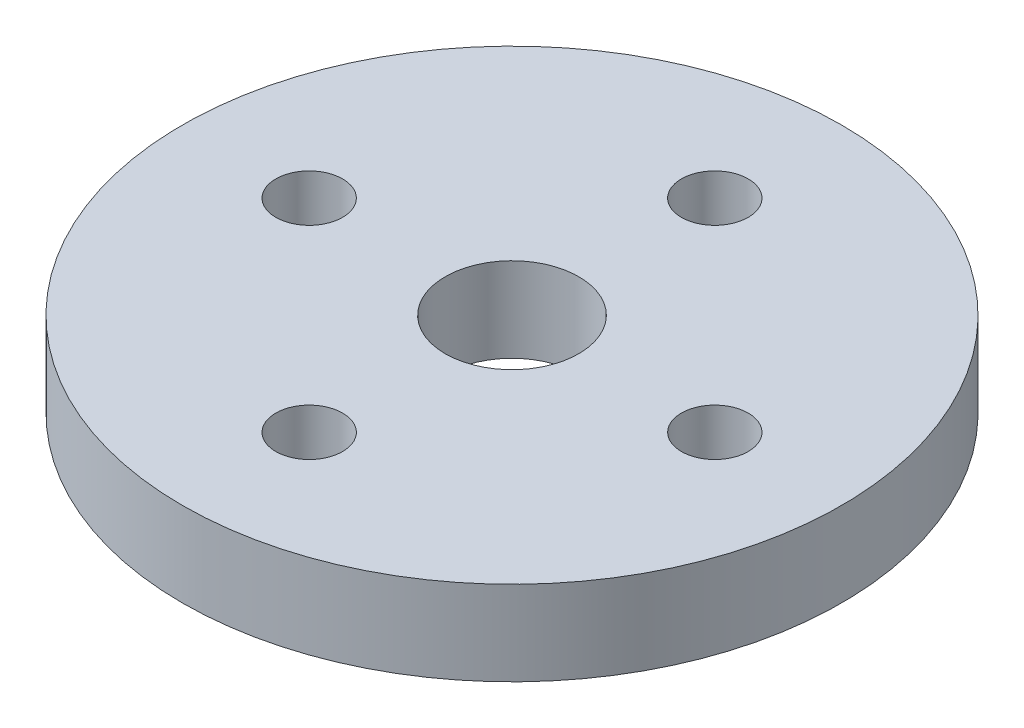
from build123d import *

# Parameters (mm, degrees)
SKETCH1_R           = 19.5
SKETCH1_R_2         = 3.95
SKETCH1_R_3         = 1.975
BOSS_EXTRUDE1_DEPTH = 5


with BuildPart() as part:
    # Sketch1 → Boss-Extrude1 (new body)
    with BuildSketch(Plane(origin=(0, 0, 0), x_dir=(1, 0, 0), z_dir=(0, 1, 0))):
        with Locations(Location((0, 0, 0), (0, 0, 270))):
            Circle(SKETCH1_R)
        with Locations(Location((0, 0, 0), (0, 0, 270))):
            Circle(SKETCH1_R_2, mode=Mode.SUBTRACT)
        with Locations(Location((0, 12, 0), (0, 0, 270))):
            Circle(SKETCH1_R_3, mode=Mode.SUBTRACT)
        with Locations(Location((-12, 0, 0), (0, 0, 270))):
            Circle(SKETCH1_R_3, mode=Mode.SUBTRACT)
        with Locations(Location((12, 0, 0), (0, 0, 90))):
            Circle(SKETCH1_R_3, mode=Mode.SUBTRACT)
        with Locations(Location((0, -12, 0), (0, 0, 90))):
            Circle(SKETCH1_R_3, mode=Mode.SUBTRACT)
    extrude(amount=BOSS_EXTRUDE1_DEPTH)


solid = part.part
